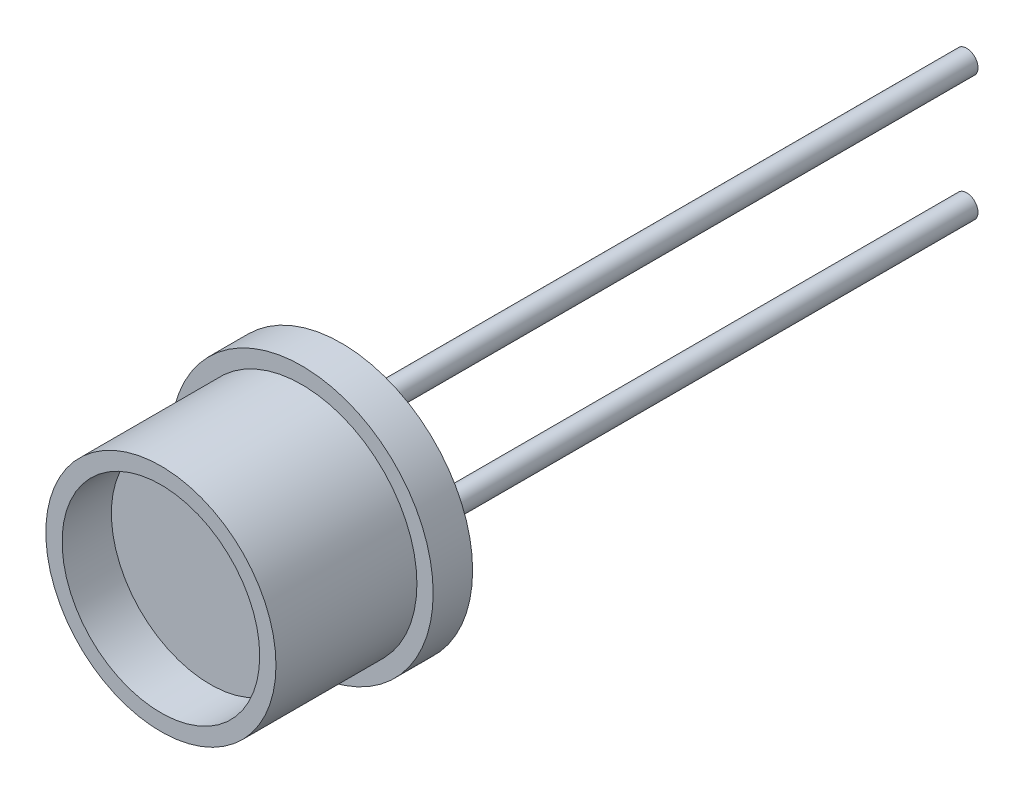
from build123d import *

# Parameters (mm, degrees)
SKETCH1_R           = 2.665
BOSS_EXTRUDE1_DEPTH = 0.8
SKETCH2_R           = 2.335
BOSS_EXTRUDE2_DEPTH = 2.86
SKETCH3_R           = 0.23
BOSS_EXTRUDE3_DEPTH = 12.69
CIRPATTERN1_COUNT   = 3
CIRPATTERN1_ANGLE   = 180
SKETCH4_R           = 2.005
CUT_EXTRUDE1_DEPTH  = 1


with BuildPart() as part:
    # Sketch1 → Boss-Extrude1 (new body)
    with BuildSketch(Plane.XY):
        Circle(SKETCH1_R)
    extrude(amount=BOSS_EXTRUDE1_DEPTH)

    # Sketch2 → Boss-Extrude2 (add)
    with BuildSketch(Plane.XY.offset(0.8)):
        Circle(SKETCH2_R)
    extrude(amount=BOSS_EXTRUDE2_DEPTH)

    # Sketch3 → Boss-Extrude3 (add)
    with BuildSketch(Plane(origin=(0, 0, 0), x_dir=(-1, 0, 0), z_dir=(0, 0, -1))):
        with Locations(Location((0, 1.27, 0), (0, 0, 180))):
            Circle(SKETCH3_R)
    boss_extrude3 = extrude(amount=BOSS_EXTRUDE3_DEPTH)

    # CirPattern1: Boss-Extrude3 ×3 about axis
    cirpattern1_axis = Axis((0, 0, 0), (0, 0, 1))
    for i in range(1, CIRPATTERN1_COUNT):
        add(boss_extrude3.rotate(cirpattern1_axis, i * CIRPATTERN1_ANGLE / (CIRPATTERN1_COUNT - 1)))

    # Sketch4 → Cut-Extrude1 (cut)
    with BuildSketch(Plane.XY.offset(3.66)):
        Circle(SKETCH4_R)
    extrude(amount=-CUT_EXTRUDE1_DEPTH, mode=Mode.SUBTRACT)


solid = part.part
